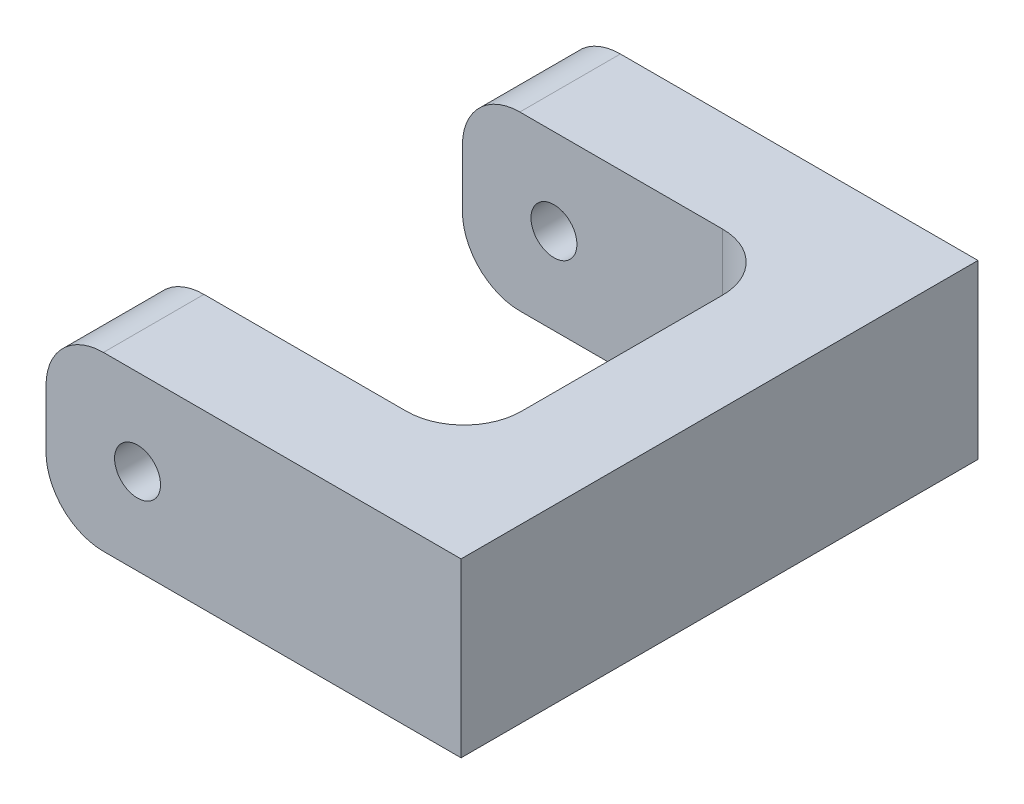
from build123d import *

# Parameters (mm, degrees)
EXTRUDE_START       = 19
EXTRUDE_1_DEPTH     = 90
SKETCH_3_W          = 57.418796995
SKETCH_3_H          = 55
CUT_EXTRUDE_1_DEPTH = 43.5
SKETCH_4_R          = 4
CUT_EXTRUDE_2_DEPTH = 100
FILLET_1_R          = 10


with BuildPart() as part:
    # Эскиз1 → Вытянуть1 (new body)
    with BuildSketch(Plane.XY.offset(EXTRUDE_START)):
        with BuildLine():
            Line((-0.114856082, -4.041900761), (-0.114856082, -14.041900761))
            ThreePointArc((-0.114856082, -14.041900761), (2.814076106, -21.112968573), (9.885143918, -24.041900761))
            Line((9.885143918, -24.041900761), (72.152697535, -24.041900761))
            Line((72.152697535, -24.041900761), (72.152697535, 5.958099239))
            Line((72.152697535, 5.958099239), (9.885143918, 5.958099239))
            ThreePointArc((9.885143918, 5.958099239), (2.814076106, 3.02916705), (-0.114856082, -4.041900761))
        make_face()
    extrude(amount=-EXTRUDE_1_DEPTH)

    # Эскиз3 → Вырез-Вытянуть1 (cut, symmetric)
    with BuildSketch(Plane(origin=(0, 0, 0), x_dir=(1, 0, 0), z_dir=(0, 1, 0))):
        with Locations((26.443299038, 26)):
            Rectangle(SKETCH_3_W, SKETCH_3_H)
    extrude(amount=CUT_EXTRUDE_1_DEPTH, both=True, mode=Mode.SUBTRACT)

    # Эскиз4 → Вырез-Вытянуть2 (cut, symmetric)
    with BuildSketch(Plane.XY):
        with Locations((15.823953055, -9.041900761)):
            Circle(SKETCH_4_R)
    extrude(amount=CUT_EXTRUDE_2_DEPTH, both=True, mode=Mode.SUBTRACT)

    # Скругление1
    fillet_1_edges = [part.edges().sort_by_distance(p)[0] for p in [
        (55.152697535, -9.041900761, -53.5),
        (55.152697535, -9.041900761, 1.5),
    ]]
    fillet(fillet_1_edges, radius=FILLET_1_R)


solid = part.part
